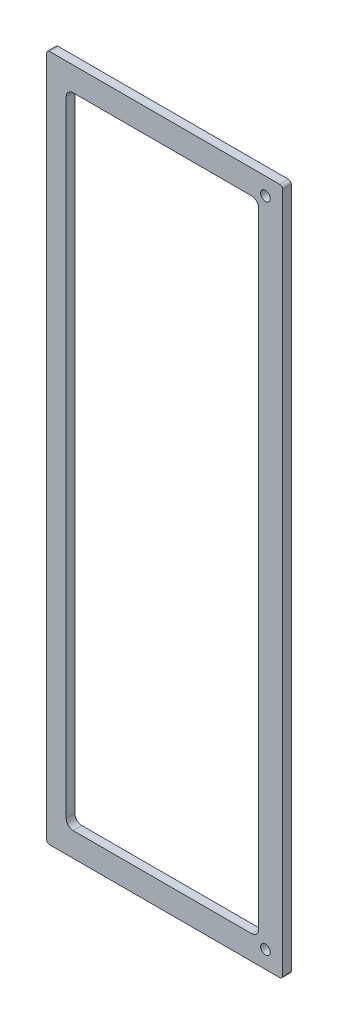
from build123d import *

# Parameters (mm, degrees)
SKETCH1_W           = 25
SKETCH1_H           = 125
SKETCH1_W_2         = 450
SKETCH1_H_2         = 25
SKETCH1_R           = 3.5
BOSS_EXTRUDE1_DEPTH = 6.35
SKETCH2_W           = 140.00000048
SKETCH2_H           = 465.00000048
CUT_EXTRUDE1_DEPTH  = 514.909352415
SKETCH3_W           = 3.25
SKETCH3_H           = 500
CUT_EXTRUDE2_DEPTH  = 514.909352415
FILLET1_R           = 2.13
FILLET2_R           = 5


with BuildPart() as part:
    # Sketch1 → Boss-Extrude1 (new body)
    # profile 1 of 6: a face of its own
    with BuildSketch(Plane(origin=(0, 0, 0), x_dir=(0, 1, 0), z_dir=(0, 0, 1))):
        Polygon((-12.5, 137.5), (12.5, 137.5), (462.5, 137.5), (487.5, 137.5), (487.5, 162.5), (-12.5, 162.5), align=None)
    # profile 2 of 6: a face of its own
    with BuildSketch(Plane(origin=(0, 0, 0), x_dir=(0, 1, 0), z_dir=(0, 0, 1))):
        with Locations((0, 75)):
            Rectangle(SKETCH1_W, SKETCH1_H)
    # profile 3 of 6: a face of its own
    with BuildSketch(Plane(origin=(0, 0, 0), x_dir=(0, 1, 0), z_dir=(0, 0, 1))):
        with Locations((237.5, 0)):
            Rectangle(SKETCH1_W_2, SKETCH1_H_2)
    # profile 4 of 6: a face of its own
    with BuildSketch(Plane(origin=(0, 0, 0), x_dir=(0, 1, 0), z_dir=(0, 0, 1))):
        with Locations((475, 75)):
            Rectangle(SKETCH1_W, SKETCH1_H)
    # profile 5 of 6: a face of its own
    with BuildSketch(Plane(origin=(0, 0, 0), x_dir=(0, 1, 0), z_dir=(0, 0, 1))):
        with Locations((475, 0)):
            Rectangle(SKETCH1_W, SKETCH1_H_2)
        with Locations(Location((475, 0, 0), (0, 0, 270))):
            Circle(SKETCH1_R, mode=Mode.SUBTRACT)
    # profile 6 of 6: a face of its own
    with BuildSketch(Plane(origin=(0, 0, 0), x_dir=(0, 1, 0), z_dir=(0, 0, 1))):
        Rectangle(SKETCH1_W, SKETCH1_H_2)
        with Locations(Location((0, 0, 0), (0, 0, 270))):
            Circle(SKETCH1_R, mode=Mode.SUBTRACT)
    extrude(amount=BOSS_EXTRUDE1_DEPTH)

    # Sketch2 → Cut-Extrude1 (cut, through all)
    with BuildSketch(Plane.XY.offset(6.35)):
        with Locations((-75, 237.5)):
            Rectangle(SKETCH2_W, SKETCH2_H)
    extrude(amount=-CUT_EXTRUDE1_DEPTH, mode=Mode.SUBTRACT)

    # Sketch3 → Cut-Extrude2 (cut, through all)
    with BuildSketch(Plane.XY.offset(6.35)):
        with Locations((-160.875, 237.5)):
            Rectangle(SKETCH3_W, SKETCH3_H)
    extrude(amount=-CUT_EXTRUDE2_DEPTH, mode=Mode.SUBTRACT)

    # Fillet1
    fillet1_edges = [part.edges().sort_by_distance(p)[0] for p in [
        (12.5, 487.5, 3.175),
        (12.5, -12.5, 3.175),
        (-159.25, 487.5, 3.175),
        (-159.25, -12.5, 3.175),
    ]]
    fillet(fillet1_edges, radius=FILLET1_R)

    # Fillet2
    fillet2_edges = [part.edges().sort_by_distance(p)[0] for p in [
        (-4.99999976, 470.00000024, 3.175),
        (-4.99999976, 4.99999976, 3.175),
        (-145.00000024, 4.99999976, 3.175),
        (-145.00000024, 470.00000024, 3.175),
    ]]
    fillet(fillet2_edges, radius=FILLET2_R)


solid = part.part
